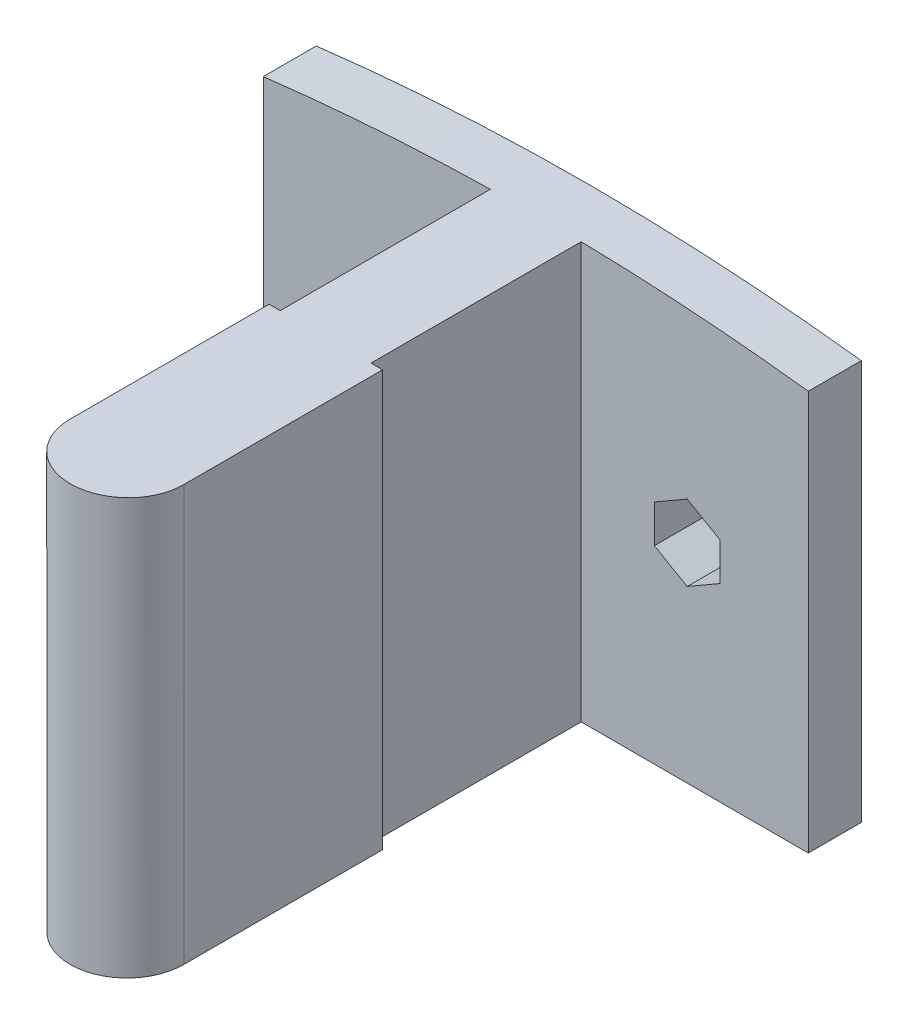
from build123d import *

# Parameters (mm, degrees)
BOSS_EXTRUDE1_DEPTH = 11
CUT_EXTRUDE1_DEPTH  = 20.949937343
CUT_EXTRUDE2_DEPTH  = 19.601075238
CUT_EXTRUDE3_DEPTH  = 20.949937343
CUT_EXTRUDE4_DEPTH  = 20.949937514


with BuildPart() as part:
    # Sketch1 → Boss-Extrude1 (new body)
    with BuildSketch(Plane(origin=(0, 0, 0), x_dir=(1, 0, 0), z_dir=(0, 1, 0))):
        Polygon((0, 0), (0, 12), (-6, 12), (-6, 14), (9, 14), (9, 12), (3, 12), (3, 0), align=None)
    extrude(amount=BOSS_EXTRUDE1_DEPTH)

    # Sketch3 → Cut-Extrude1 (cut, through all)
    with BuildSketch(Plane(origin=(0, 0, -14), x_dir=(-1, 0, 0), z_dir=(0, 0, -1))):
        with BuildLine():
            Line((-9, 11), (-9, 10.529404499))
            ThreePointArc((-9, 10.529404499), (-5.257374753, 10.882235554), (-1.5, 11))
            Line((-1.5, 11), (-9, 11))
        make_face()
        with BuildLine():
            Line((6, 11), (-1.5, 11))
            ThreePointArc((-1.5, 11), (2.257374753, 10.882235554), (6, 10.529404499))
            Line((6, 10.529404499), (6, 11))
        make_face()
    extrude(amount=-CUT_EXTRUDE1_DEPTH, mode=Mode.SUBTRACT)

    # Sketch4 → Cut-Extrude2 (cut, through all)
    with BuildSketch(Plane.XY.offset(-12)):
        Polygon((-2.5, 6.5), (-3.366025404, 6), (-3.366025404, 5), (-2.5, 4.5), (-1.633974596, 5), (-1.633974596, 6), align=None)
        Polygon((5.5, 6.5), (4.633974596, 6), (4.633974596, 5), (5.5, 4.5), (6.366025404, 5), (6.366025404, 6), align=None)
    extrude(amount=-CUT_EXTRUDE2_DEPTH, mode=Mode.SUBTRACT)

    # Sketch7 → Cut-Extrude3 (cut, through all)
    with BuildSketch(Plane.XZ):
        with BuildLine():
            ThreePointArc((0, -1.5), (0.439339828, -0.439339828), (1.5, 0))
            Line((1.5, 0), (0, 0))
            Line((0, 0), (0, -1.5))
        make_face()
        with BuildLine():
            Line((3, -1.5), (3, 0))
            Line((3, 0), (1.5, 0))
            ThreePointArc((1.5, 0), (2.560660172, -0.439339828), (3, -1.5))
        make_face()
    extrude(amount=-CUT_EXTRUDE3_DEPTH, mode=Mode.SUBTRACT)

    # Sketch8 → Cut-Extrude4 (cut, through all)
    with BuildSketch(Plane.XZ):
        Polygon((0.3, -6.75), (0, -6.75), (0, -12), (-6, -12), (-6, -14), (9, -14), (9, -12), (3, -12), (3, -6.75), (2.7, -6.75), (2.7, -12.3), (8.7, -12.3), (8.7, -13.7), (-5.7, -13.7), (-5.7, -12.3), (0.3, -12.3), align=None)
    extrude(amount=-CUT_EXTRUDE4_DEPTH, mode=Mode.SUBTRACT)


solid = part.part
